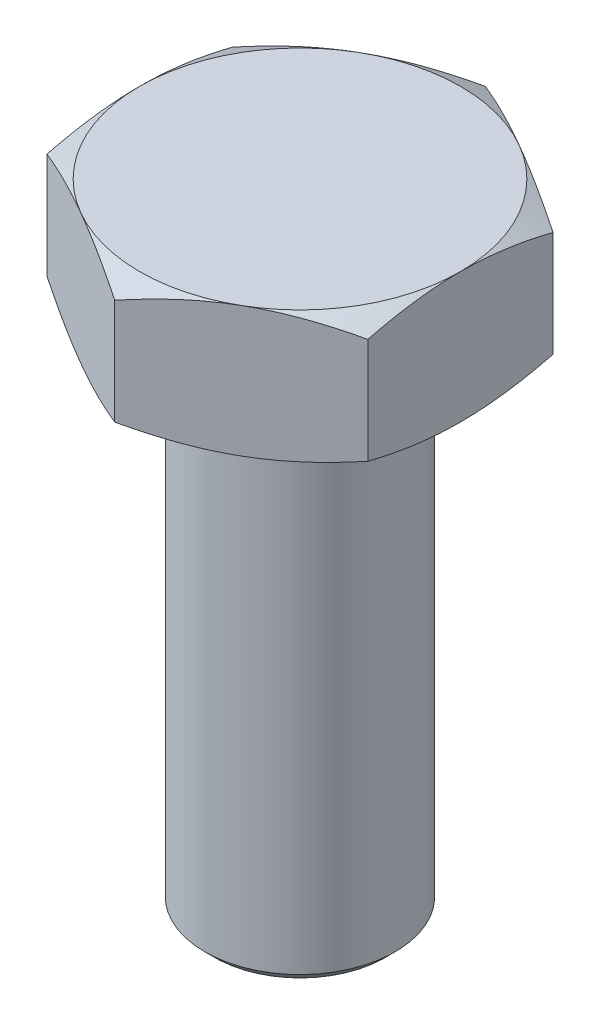
from build123d import *

# Parameters (mm, degrees)
BOSS_EXTRUDE1_DEPTH = 6.5
SKETCH3_R           = 4.75
BOSS_EXTRUDE2_DEPTH = 25
CHAMFER1_SIZE       = 0.5
CHAMFER2_SIZE       = 0.3


with BuildPart() as part:
    # Sketch1 → Boss-Extrude1 (new body)
    with BuildSketch(Plane(origin=(0, 0, 0), x_dir=(1, 0, 0), z_dir=(0, 1, 0))):
        Polygon((0, 9.237604307), (-8, 4.618802154), (-8, -4.618802154), (0, -9.237604307), (8, -4.618802154), (8, 4.618802154), align=None)
    extrude(amount=-BOSS_EXTRUDE1_DEPTH)

    # Sketch2 → Cut-Revolve1 (revolve, cut)
    with BuildSketch(Plane.XY):
        Polygon((-11, -1.5), (-8, 0), (-8, 1), (-11, 1), align=None)
    cut_revolve1 = revolve(axis=Axis((0, 50, 0), (0, -1, 0)), mode=Mode.SUBTRACT)

    # Sketch3 → Boss-Extrude2 (add)
    with BuildSketch(Plane.XZ.offset(6.5)):
        with Locations(Location((0, 0, 0), (0, 0, 270))):
            Circle(SKETCH3_R)
    extrude(amount=BOSS_EXTRUDE2_DEPTH)

    # Chamfer1
    chamfer1_edges = [part.edges().sort_by_distance(p)[0] for p in [
        (0, -31.5, 4.75),
    ]]
    chamfer(chamfer1_edges, length=CHAMFER1_SIZE)

    # Mirror1: Cut-Revolve1 across plane
    add(cut_revolve1.mirror(Plane(origin=(0, -3.25, 0), x_dir=(0, 0, 1), z_dir=(0, -1, 0))), mode=Mode.SUBTRACT)

    # Chamfer2
    chamfer2_edges = [part.edges().sort_by_distance(p)[0] for p in [
        (0, -6.5, 4.75),
    ]]
    chamfer(chamfer2_edges, length=CHAMFER2_SIZE)


solid = part.part
